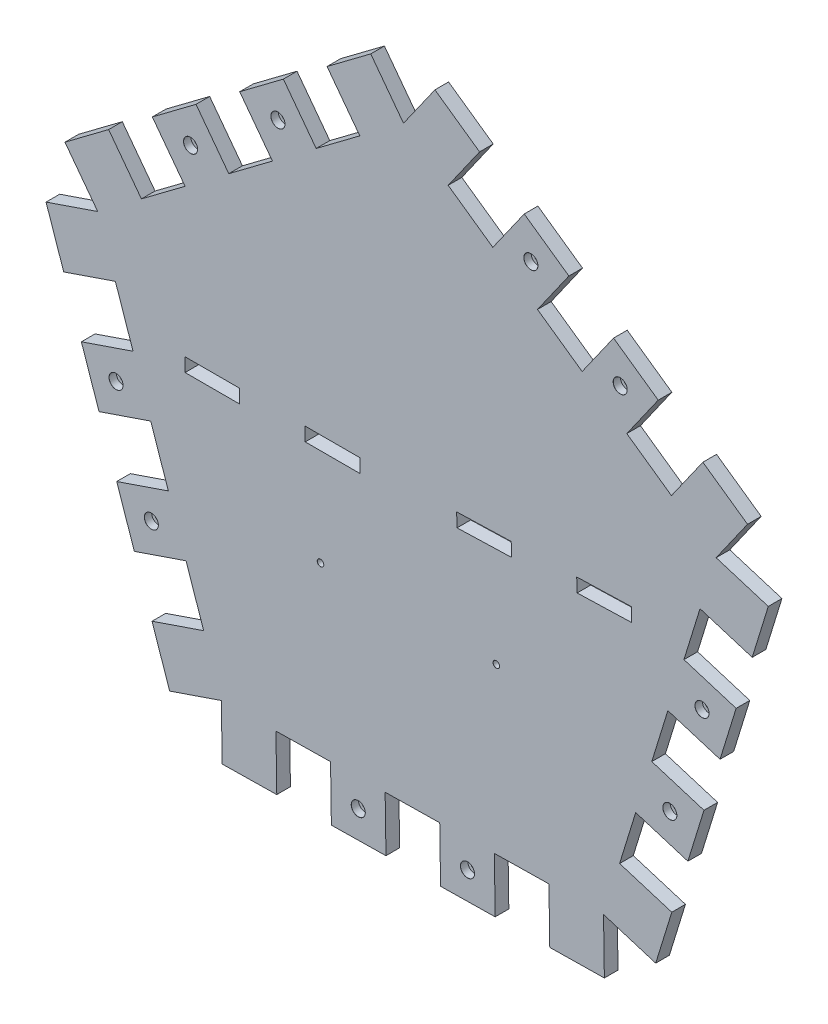
from build123d import *

# Parameters (mm, degrees)
SKETCH1_W                                    = 25.4
SKETCH1_H                                    = 6.35
BOSS_EXTRUDE3_DEPTH                          = 6.35
BOSS_EXTRUDE5_DEPTH                          = 6.35
CBORE_FOR_M3_HEX_SOCKET_HEAD_CAP_SCR_2_COUNT = 2
CBORE_FOR_M3_HEX_SOCKET_HEAD_CAP_SCR_2_PITCH = 50.8
CIRPATTERN1_COUNT                            = 5
F_3_0MM_DOWEL_HOLE1_D                        = 3
F_3_0MM_DOWEL_HOLE1_CSINK_D                  = 3.05
F_3_0MM_DOWEL_HOLE1_CSINK_ANGLE              = 90


with BuildPart() as part:
    # Sketch1 → Boss-Extrude3 (new body)
    with BuildSketch(Plane.XY):
        Polygon((-103.896211638, 75.028282184), (-124.216211638, 59.788282184), (-139.456211638, 80.108282184), (-159.776211638, 64.868282184), (-144.536211638, 44.548282184), (-168.571099043, 36.333406201), (-160.356223061, 12.298518796), (-136.321335655, 20.513394779), (-128.106459673, -3.521492627), (-152.141347078, -11.73636861), (-143.926471095, -35.771256015), (-119.89158369, -27.556380032), (-111.676707707, -51.591267438), (-135.711595113, -59.80614342), (-127.49671913, -83.841030826), (-103.461831725, -75.626154843), (-95.246955742, -99.661042248), (-119.281843147, -107.875918231), (-111.066967165, -131.910805636), (-87.032079759, -123.695929654), (-86.646457092, -149.093002224), (-61.249384521, -148.707379557), (-61.635007189, -123.310306986), (-36.237934618, -122.924684318), (-35.85231195, -148.321756889), (-10.45523938, -147.936134221), (-10.840862048, -122.539061651), (14.556210523, -122.153438983), (14.941833191, -147.550511554), (40.338905761, -147.164888886), (39.953283094, -121.767816315), (65.350355664, -121.382193648), (65.735978332, -146.779266218), (91.133050903, -146.393643551), (90.747428235, -120.99657098), (115.020643556, -128.477949061), (122.502021637, -104.20473374), (98.228806316, -96.723355659), (105.710184397, -72.450140338), (129.983399717, -79.931518419), (137.464777798, -55.658303098), (113.191562477, -48.176925017), (120.672940558, -23.903709697), (144.946155879, -31.385087777), (152.42753396, -7.111872456), (128.154318639, 0.369505624), (135.63569672, 24.642720945), (159.90891204, 17.161342864), (167.390290121, 41.434558185), (143.1170748, 48.915936266), (157.733124217, 69.6892629), (136.959797583, 84.305312317), (122.343748166, 63.531985683), (101.570421532, 78.1480351), (116.186470949, 98.921361734), (95.413144315, 113.537411151), (80.797094898, 92.764084517), (60.023768264, 107.380133933), (74.639817681, 128.153460567), (53.866491047, 142.769509984), (39.25044163, 121.99618335), (18.477114996, 136.612232767), (33.093164413, 157.385559401), (12.319837779, 172.001608818), (-2.296211638, 151.228282184), (-17.536211638, 171.548282184), (-37.856211638, 156.308282184), (-22.616211638, 135.988282184), (-83.576211638, 90.268282184), (-98.816211638, 110.588282184), (-119.136211638, 95.348282184), align=None)
        with Locations((-91.196211638, 3.175)):
            Rectangle(SKETCH1_W, SKETCH1_H, mode=Mode.SUBTRACT)
        with Locations((-35.316211638, 3.175)):
            Rectangle(SKETCH1_W, SKETCH1_H, mode=Mode.SUBTRACT)
        Polygon((22.412996771, 7.033712007), (47.801287728, 7.804868454), (47.99407684, 1.457795715), (22.605785883, 0.686639268), align=None, mode=Mode.SUBTRACT)
        Polygon((103.655527834, 9.501412638), (103.848316946, 3.154339898), (78.460025989, 2.383183451), (78.267236877, 8.730256191), align=None, mode=Mode.SUBTRACT)
    extrude(amount=BOSS_EXTRUDE3_DEPTH)

    # Sketch1<6> → Boss-Extrude5 (add)
    with BuildSketch(Plane.XY):
        Polygon((-78.496211638, 125.828282184), (-63.256211638, 105.508282184), (-42.936211638, 120.748282184), (-58.176211638, 141.068282184), align=None)
    extrude(amount=BOSS_EXTRUDE5_DEPTH)

    # Sketch10 → CBORE for M3 Hex Socket Head Cap Screw1 (revolve, cut)
    with BuildSketch(Plane(origin=(-60.716211638, 123.288282184, 6.35), x_dir=(0, -1, 0), z_dir=(1, 0, 0))):
        Polygon((0, 0), (0, 6.35), (1.7, 6.35), (1.7, 3.4), (3.25, 3.4), (3.25, 0.025), (3.275, 0), align=None)
    cbore_for_m3_hex_socket_head_cap_screw1 = revolve(axis=Axis((-60.716211638, 123.288282184, 12.7), (0, 0, -1)), mode=Mode.SUBTRACT)

    # CBORE for M3 Hex Socket Head Cap Scr 2: CBORE for M3 Hex Socket Head Cap Screw1 ×2
    with Locations(*[Vector(-0.8, -0.5999999999999999, 0) * (i * CBORE_FOR_M3_HEX_SOCKET_HEAD_CAP_SCR_2_PITCH) for i in range(1, CBORE_FOR_M3_HEX_SOCKET_HEAD_CAP_SCR_2_COUNT)]):
        add(cbore_for_m3_hex_socket_head_cap_screw1, mode=Mode.SUBTRACT)

    # CirPattern1: CBORE for M3 Hex Socket Head Cap Screw1 ×5 about axis
    cirpattern1_axis = Axis((0, 0, 0), (0, 0, 1))
    for i in range(1, CIRPATTERN1_COUNT):
        add(cbore_for_m3_hex_socket_head_cap_screw1.rotate(cirpattern1_axis, i * 360 / CIRPATTERN1_COUNT), mode=Mode.SUBTRACT)

    # CirPattern1 copy 1 sketch → CirPattern1 copy 1 (revolve, cut)
    with BuildSketch(Plane(origin=(-119.586713419, -67.716149132, 6.35), x_dir=(0.9510565162951535, -0.30901699437494745, 0), z_dir=(0.30901699437494745, 0.9510565162951535, 0))):
        Polygon((0, 0), (0, 6.35), (1.7, 6.35), (1.7, 3.4), (3.25, 3.4), (3.25, 0.025), (3.275, 0), align=None)
    revolve(axis=Axis((-119.586713419, -67.716149132, 12.7), (0, 0, -1)), mode=Mode.SUBTRACT)

    # CirPattern1 copy 2 sketch → CirPattern1 copy 2 (revolve, cut)
    with BuildSketch(Plane(origin=(27.447558142, -134.659163935, 6.35), x_dir=(0.5877852522924732, 0.8090169943749473, 0), z_dir=(-0.8090169943749473, 0.5877852522924732, 0))):
        Polygon((0, 0), (0, 6.35), (1.7, 6.35), (1.7, 3.4), (3.25, 3.4), (3.25, 0.025), (3.275, 0), align=None)
    revolve(axis=Axis((27.447558142, -134.659163935, 12.7), (0, 0, -1)), mode=Mode.SUBTRACT)

    # CirPattern1 copy 3 sketch → CirPattern1 copy 3 (revolve, cut)
    with BuildSketch(Plane(origin=(136.550237259, -15.507791077, 6.35), x_dir=(-0.587785252292473, 0.8090169943749476, 0), z_dir=(-0.8090169943749476, -0.587785252292473, 0))):
        Polygon((0, 0), (0, 6.35), (1.7, 6.35), (1.7, 3.4), (3.25, 3.4), (3.25, 0.025), (3.275, 0), align=None)
    revolve(axis=Axis((136.550237259, -15.507791077, 12.7), (0, 0, -1)), mode=Mode.SUBTRACT)

    # CirPattern1 copy 4 sketch → CirPattern1 copy 4 (revolve, cut)
    with BuildSketch(Plane(origin=(56.945129656, 125.074821959, 6.35), x_dir=(-0.9510565162951536, -0.30901699437494723, 0), z_dir=(0.30901699437494723, -0.9510565162951536, 0))):
        Polygon((0, 0), (0, 6.35), (1.7, 6.35), (1.7, 3.4), (3.25, 3.4), (3.25, 0.025), (3.275, 0), align=None)
    revolve(axis=Axis((56.945129656, 125.074821959, 12.7), (0, 0, -1)), mode=Mode.SUBTRACT)

    # Ø3.0mm Dowel Hole1 (through all)
    with Locations(Plane.XY.offset(6.35)):
        with Locations((-40.904211638, -45.212), (40.883788362, -45.212)):
            CounterSinkHole(F_3_0MM_DOWEL_HOLE1_D / 2, F_3_0MM_DOWEL_HOLE1_CSINK_D / 2, counter_sink_angle=F_3_0MM_DOWEL_HOLE1_CSINK_ANGLE)


solid = part.part
